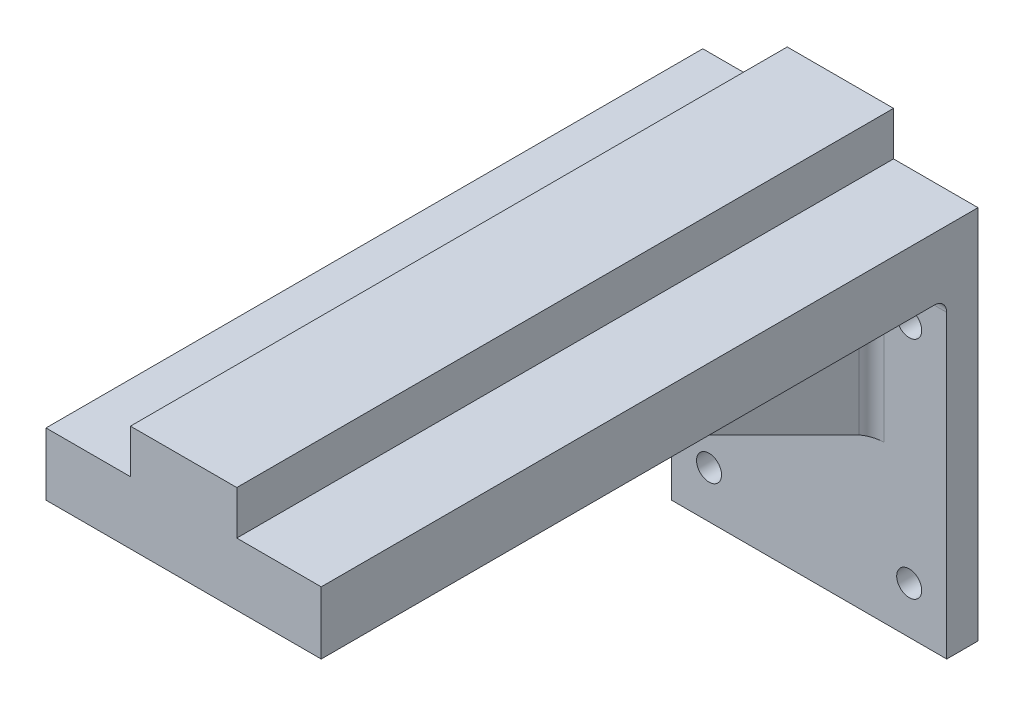
from build123d import *

# Parameters (mm, degrees)
BOSS_EXTRUDE1_DEPTH = 5
SKETCH2_R           = 2
CUT_EXTRUDE1_DEPTH  = 5
SKETCH3_W           = 44
SKETCH3_H           = 10
BOSS_EXTRUDE2_DEPTH = 100
BOSS_EXTRUDE3_DEPTH = 10
FILLET1_R           = 2
SKETCH5_W           = 17
SKETCH5_H           = 105
BOSS_EXTRUDE4_DEPTH = 7


with BuildPart() as part:
    # Sketch1 → Boss-Extrude1 (new body)
    with BuildSketch(Plane.XY):
        Polygon((0, 0), (-22, 0), (-22, 60), (22, 60), (22, 0), align=None)
    extrude(amount=BOSS_EXTRUDE1_DEPTH)

    # Sketch2 → Cut-Extrude1 (cut)
    with BuildSketch(Plane(origin=(0, 0, 0), x_dir=(-1, 0, 0), z_dir=(0, 0, -1))):
        with Locations((-16, 43.5)):
            Circle(SKETCH2_R)
        with Locations((16, 43.5)):
            Circle(SKETCH2_R)
        with Locations((-16, 7.5)):
            Circle(SKETCH2_R)
        with Locations((16, 7.5)):
            Circle(SKETCH2_R)
    extrude(amount=-CUT_EXTRUDE1_DEPTH, mode=Mode.SUBTRACT)

    # Sketch3 → Boss-Extrude2 (add)
    with BuildSketch(Plane.XY.offset(5)):
        with Locations((0, 55)):
            Rectangle(SKETCH3_W, SKETCH3_H)
    extrude(amount=BOSS_EXTRUDE2_DEPTH)

    # Sketch4 → Boss-Extrude3 (add, symmetric)
    with BuildSketch(Plane(origin=(0, 0, 0), x_dir=(0, 0, -1), z_dir=(1, 0, 0))):
        Polygon((-5, 50), (-5, 25), (-55, 50), align=None)
    extrude(amount=BOSS_EXTRUDE3_DEPTH, both=True)

    # Fillet1
    fillet1_edges = [part.edges().sort_by_distance(p)[0] for p in [
        (16, 50, 5),
        (10, 37.5, 5),
        (10, 50, 30),
        (-16, 50, 5),
        (-10, 37.5, 5),
        (-10, 50, 30),
    ]]
    fillet(fillet1_edges, radius=FILLET1_R)

    # Sketch5 → Boss-Extrude4 (add)
    with BuildSketch(Plane(origin=(0, 60, 0), x_dir=(1, 0, 0), z_dir=(0, 1, 0))):
        with Locations((0, -52.5)):
            Rectangle(SKETCH5_W, SKETCH5_H)
    extrude(amount=BOSS_EXTRUDE4_DEPTH)


solid = part.part
